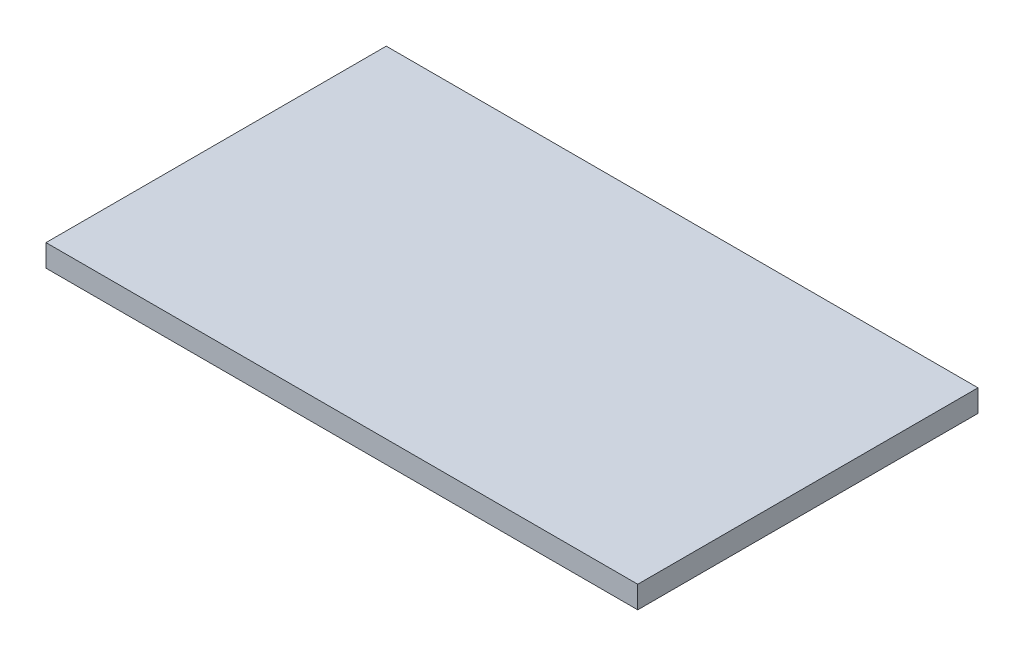
from build123d import *

# Parameters (mm, degrees)
SKETCH1_W           = 508
SKETCH1_H           = 292.1
BOSS_EXTRUDE1_DEPTH = 19.05


with BuildPart() as part:
    # Sketch1 → Boss-Extrude1 (new body)
    with BuildSketch(Plane(origin=(0, 0, 0), x_dir=(1, 0, 0), z_dir=(0, 1, 0))):
        with Locations((254, 146.05)):
            Rectangle(SKETCH1_W, SKETCH1_H)
    extrude(amount=BOSS_EXTRUDE1_DEPTH)


solid = part.part
